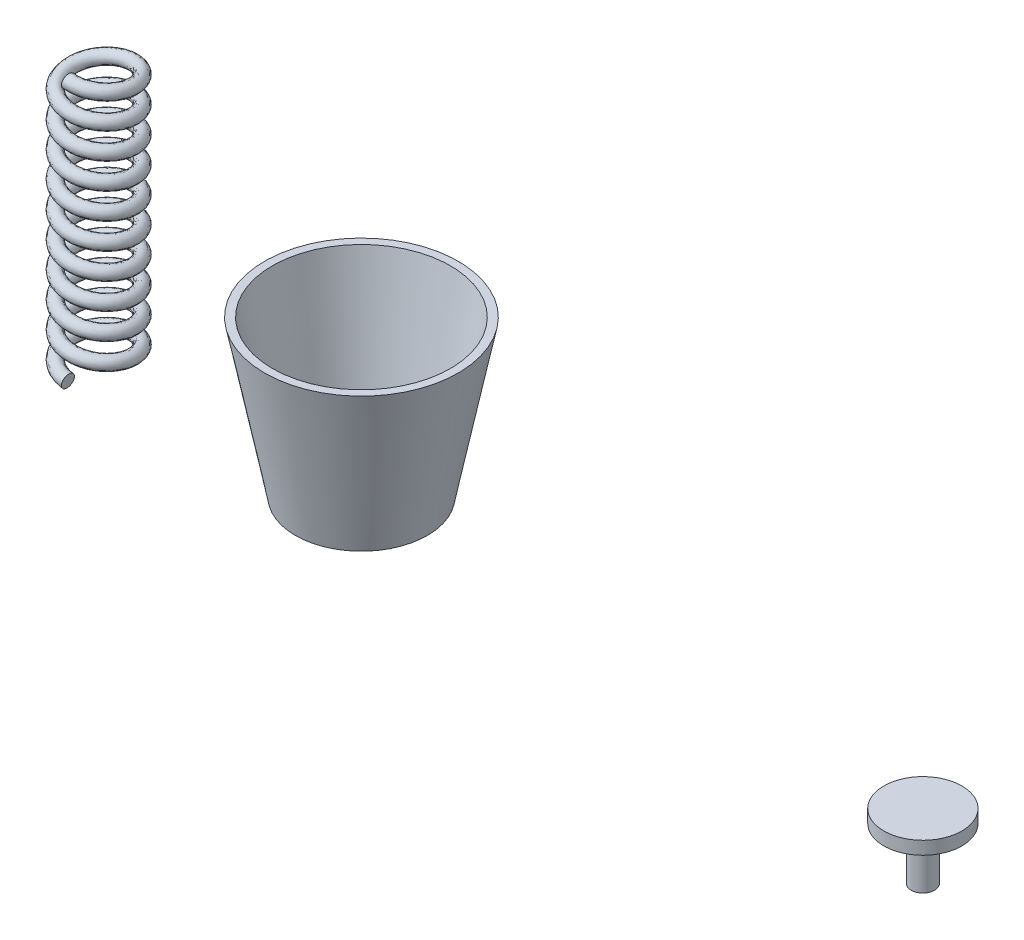
from build123d import *

# Parameters (mm, degrees)
SWEEP_1_PITCH     = 10
SWEEP_1_HEIGHT    = 100
SWEEP_1_RADIUS    = 11.81024341
SWEEP_1_PROFILE_R = 2.5


with BuildPart() as part:
    # 扫描1: sweep along a helix
    with BuildLine() as sweep_1_path:
        Helix(SWEEP_1_PITCH, SWEEP_1_HEIGHT, SWEEP_1_RADIUS, center=(40.496481298, 0, -6.977682255), direction=(0, 1, 0), lefthand=True)
    # 扫描1 profile (on start of the path) → 扫描1 (sweep)
    with BuildSketch(Plane(origin=(40.496481298, 0, 4.832561155), x_dir=(-0.13355286456503437, -0.9910416905289473, 0), z_dir=(-0.9910416905289473, 0.13355286456503437, -1.0692180774800232e-13))):
        Circle(SWEEP_1_PROFILE_R)
    sweep(path=sweep_1_path.line, is_frenet=True)


with BuildPart() as body_2:
    # 草图18 → 旋转2 (revolve)
    with BuildSketch(Plane.XY, mode=Mode.PRIVATE) as revolve_2_sk:
        Polygon((148.483161021, 12.836227195), (173.871468301, 12.836227195), (185.707038233, 72.836227195), (182.707038233, 72.836227195), (171.660506297, 16.836227195), (148.483161021, 16.836227195), align=None)
    revolve(revolve_2_sk.sketch.rotate(Axis((148.483161021, 16.836227195, 0), (0, -1, 0)), 90), axis=Axis((148.483161021, 16.836227195, 0), (0, -1, 0)))


with BuildPart() as body_3:
    # 草图19 → 旋转3 (revolve)
    with BuildSketch(Plane.XY, mode=Mode.PRIVATE) as revolve_3_sk:
        Polygon((278.520757267, 47.963955432), (293.520757267, 47.963955432), (293.520757267, 22.963955432), (289.020757267, 22.963955432), (289.020757267, 42.963955432), (278.520757267, 42.963955432), align=None)
    revolve(revolve_3_sk.sketch.rotate(Axis((293.520757267, 22.963955432, 0), (0, 1, 0)), 270), axis=Axis((293.520757267, 22.963955432, 0), (0, 1, 0)))


with BuildPart() as body_3_1:
    # Move Body 1: moved
    add(body_3.part.moved(Location((0, -30.775042956, 0))))


with BuildPart() as body_3_2:
    # Move Body 2: moved
    add(body_3_1.part.moved(Location((70.799244894, 0, 0))))


solid = Compound([part.part, body_2.part, body_3_2.part])
